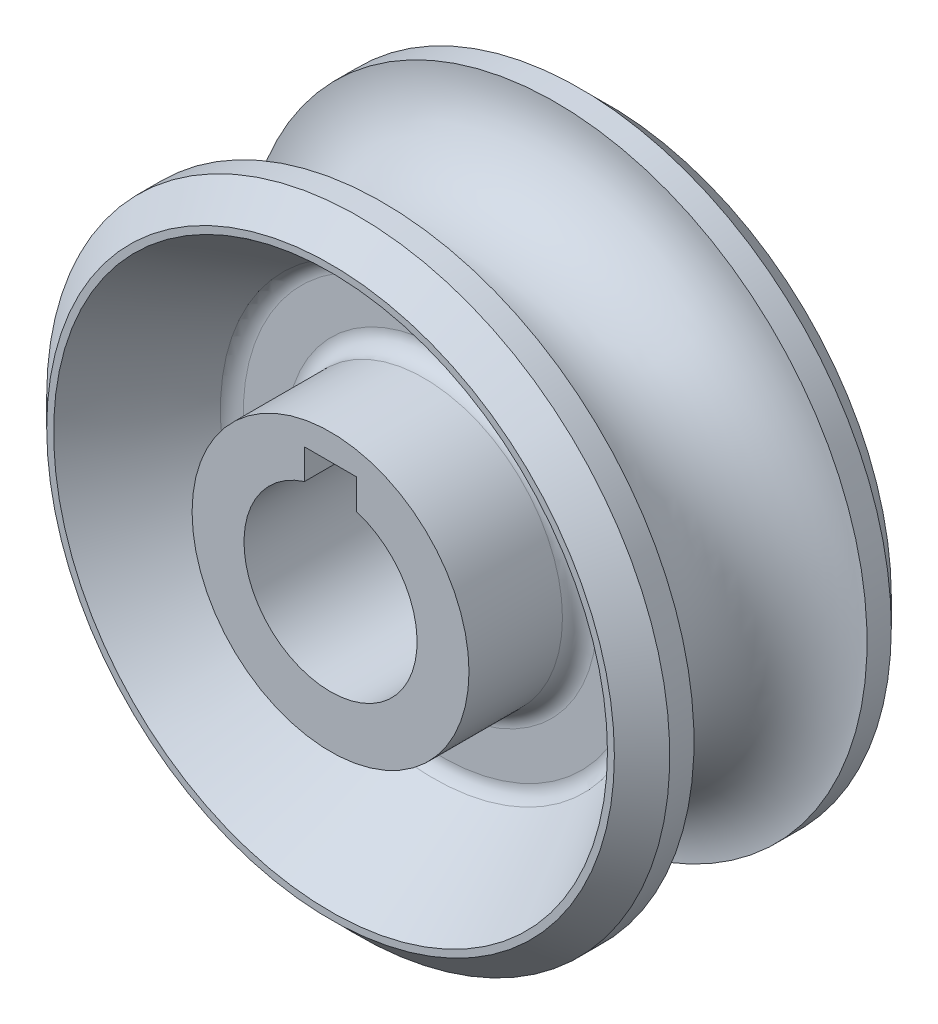
from build123d import *

# Parameters (mm, degrees)
SKETCH1_R               = 28.575
SKETCH1_R_2             = 7.9375
BASE_DEPTH              = 12.7
SKETCH3_R               = 7.9375
CHAMFER1_SIZE           = 2.54
FILLET1_R               = 1.5875
CUT_EXTRUDE1_DEPTH      = 43.359783404
CUT_EXTRUDE1_DEPTH_BACK = 43.359783404
SKETCH5_W               = 4.7752
SKETCH5_H               = 10.3251


with BuildPart() as part:
    # Sketch1 → Base (new, symmetric)
    with BuildSketch(Plane.XY):
        with Locations(Location((0, 0, 0), (0, 0, 180))):
            Circle(SKETCH1_R)
        with Locations(Location((0, 0, 0), (0, 0, 180))):
            Circle(SKETCH1_R_2, mode=Mode.SUBTRACT)
    extrude(amount=BASE_DEPTH, both=True)

    # Sketch3 → Cut-Revolve1 (revolve, cut)
    with BuildSketch(Plane(origin=(0, 0, 0), x_dir=(0, 0, -1), z_dir=(1, 0, 0)), mode=Mode.PRIVATE) as cut_revolve1_sk:
        with Locations((0, 28.575)):
            Circle(SKETCH3_R)
    revolve(cut_revolve1_sk.sketch.rotate(Axis((0, 0, 0), (0, 0, -1)), 270), axis=Axis((0, 0, 0), (0, 0, -1)), mode=Mode.SUBTRACT)

    # Sketch4 → Cut-Revolve2 (revolve, cut)
    with BuildSketch(Plane(origin=(0, 0, 0), x_dir=(0, 0, -1), z_dir=(1, 0, 0)), mode=Mode.PRIVATE) as cut_revolve2_sk:
        Polygon((12.7, 25.4), (12.7, 12.7), (2.54, 12.7), (2.54, 19.05), align=None)
        Polygon((-2.54, 12.7), (-2.54, 19.05), (-12.7, 25.4), (-12.7, 12.7), align=None)
    revolve(cut_revolve2_sk.sketch.rotate(Axis((0, 0, 0), (0, 0, -1)), 90), axis=Axis((0, 0, 0), (0, 0, -1)), mode=Mode.SUBTRACT)

    # Chamfer1
    chamfer1_edges = [part.edges().sort_by_distance(p)[0] for p in [
        (28.575, 0, -12.7),
        (28.575, 0, 12.7),
    ]]
    chamfer(chamfer1_edges, length=CHAMFER1_SIZE)

    # Fillet1
    fillet1_edges = [part.edges().sort_by_distance(p)[0] for p in [
        (-12.7, 0, -2.54),
        (-19.05, 0, -2.54),
        (-12.7, 0, 2.54),
        (-19.05, 0, 2.54),
    ]]
    fillet(fillet1_edges, radius=FILLET1_R)

    # Sketch5 → Cut-Extrude1 (cut, two sides: drawn at the far end of the back side and taken through both)
    with BuildSketch(Plane.XY.offset(-CUT_EXTRUDE1_DEPTH_BACK)):
        with Locations((0, 5.16255)):
            Rectangle(SKETCH5_W, SKETCH5_H)
    extrude(amount=CUT_EXTRUDE1_DEPTH + CUT_EXTRUDE1_DEPTH_BACK, mode=Mode.SUBTRACT)


solid = part.part
